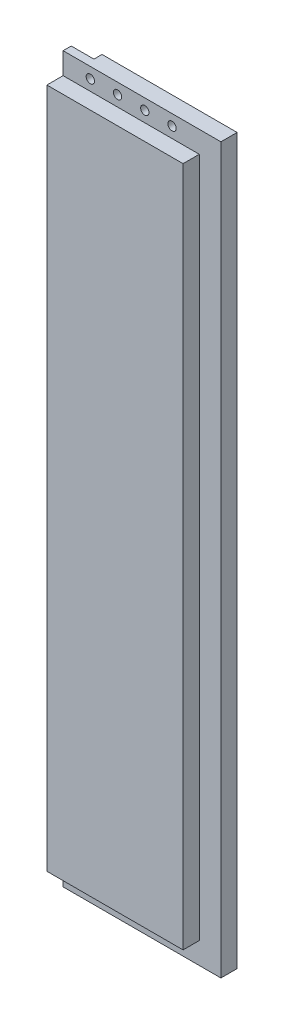
from build123d import *

# Parameters (mm, degrees)
SKETCH1_W             = 92.7
SKETCH1_H             = 19.05
BOSS_EXTRUDE1_DEPTH   = 425.45
SKETCH2_W             = 9.525
SKETCH2_H             = 12.7
CUT_EXTRUDE1_DEPTH    = 436.716109536
SKETCH3_W             = 12.7
SKETCH3_H             = 9.525
CUT_EXTRUDE2_DEPTH    = 419.595052861
F_8_CLEARANCE_HOLE1_D = 4.9149
SKETCH6_W             = 13.335
SKETCH6_H             = 4.7498
CUT_EXTRUDE5_DEPTH    = 436.848477111


with BuildPart() as part:
    # Sketch1 → Boss-Extrude1 (new body)
    with BuildSketch(Plane(origin=(0, 0, 0), x_dir=(1, 0, 0), z_dir=(0, 1, 0))):
        with Locations((-21.55964711, -6.208264412)):
            Rectangle(SKETCH1_W, SKETCH1_H)
    extrude(amount=BOSS_EXTRUDE1_DEPTH)

    # Sketch2 → Cut-Extrude1 (cut, through all)
    with BuildSketch(Plane(origin=(24.79035289, 0, 0), x_dir=(0, 0, -1), z_dir=(1, 0, 0))):
        with Locations((-10.970764412, 419.1)):
            Rectangle(SKETCH2_W, SKETCH2_H)
        with Locations((-10.970764412, 6.35)):
            Rectangle(SKETCH2_W, SKETCH2_H)
    extrude(amount=-CUT_EXTRUDE1_DEPTH, mode=Mode.SUBTRACT)

    # Sketch3 → Cut-Extrude2 (cut, through all)
    with BuildSketch(Plane.XZ.offset(-12.7)):
        with Locations((18.44035289, 10.970764412)):
            Rectangle(SKETCH3_W, SKETCH3_H)
    extrude(amount=-CUT_EXTRUDE2_DEPTH, mode=Mode.SUBTRACT)

    # #8 Clearance Hole1 (through all)
    with Locations(Plane.XY.offset(6.208264412)):
        with Locations((-51.91764711, 6.35), (-35.91564711, 6.35), (-19.91364711, 6.35), (-3.91164711, 6.35), (-51.91764711, 419.1), (-35.91564711, 419.1), (-19.91364711, 419.1), (-3.91164711, 419.1)):
            Hole(F_8_CLEARANCE_HOLE1_D / 2)

    # Sketch6 → Cut-Extrude5 (cut, through all)
    with BuildSketch(Plane(origin=(-67.90964711, 425.45, -3.316735588), x_dir=(1, 0, 0), z_dir=(0, -1, 0))):
        with Locations((6.6675, 2.3749)):
            Rectangle(SKETCH6_W, SKETCH6_H)
    extrude(amount=CUT_EXTRUDE5_DEPTH, mode=Mode.SUBTRACT)


solid = part.part
